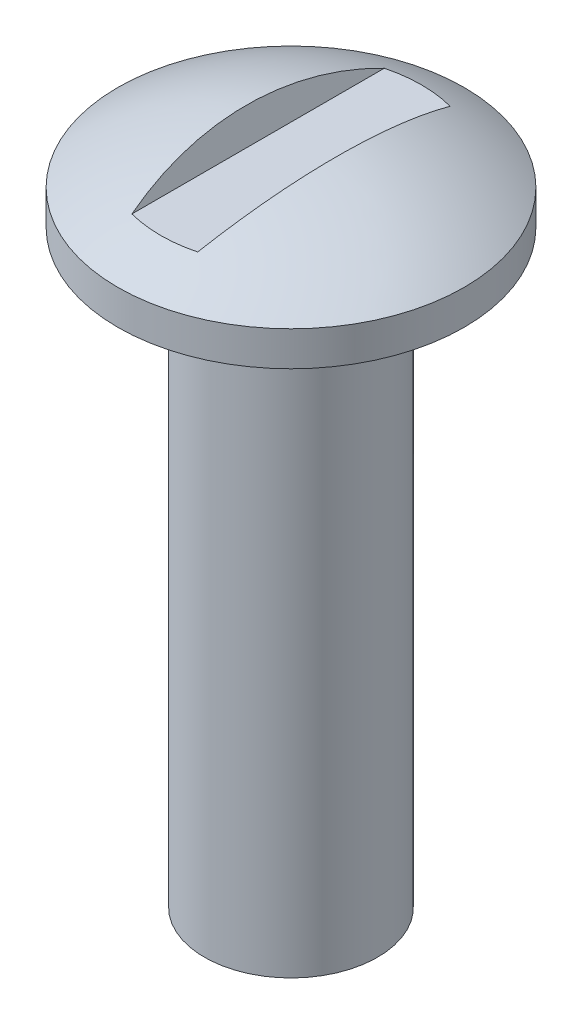
from build123d import *

# Parameters (mm, degrees)
DOME1_FACE_RADIUS       = 12.7
DOME1_HEIGHT            = 3.81
CUT_EXTRUDE1_DEPTH      = 53.685870022
CUT_EXTRUDE1_DEPTH_BACK = 53.685870022


with BuildPart() as part:
    # Sketch1 → Revolve2 (revolve)
    with BuildSketch(Plane.XY, mode=Mode.PRIVATE) as revolve2_sk:
        Polygon((0, 0), (0, 45.72), (-12.7, 45.72), (-12.7, 43.18), (-6.35, 43.18), (-6.35, 0), (-0.453180755, 0), align=None)
    revolve(revolve2_sk.sketch.rotate(Axis((0, 0, 0), (0, 1, 0)), 270), axis=Axis((0, 0, 0), (0, 1, 0)))

    # Dome1: a dome of height H over a round flat face of radius A is a cap of a sphere of radius (A * A + H * H) / (2 * H)
    dome1_r = (DOME1_FACE_RADIUS * DOME1_FACE_RADIUS + DOME1_HEIGHT * DOME1_HEIGHT) / (2 * DOME1_HEIGHT)
    dome1_base = Plane((0, 45.72, 0), z_dir=(0, 1, 0))
    with Locations(dome1_base.offset(DOME1_HEIGHT - dome1_r)):
        dome1_ball = Sphere(dome1_r, mode=Mode.PRIVATE)
    add(split(dome1_ball, bisect_by=dome1_base, keep=Keep.TOP, mode=Mode.PRIVATE))

    # Sketch2 → Cut-Extrude1 (cut, two sides: drawn at the far end of the back side and taken through both)
    with BuildSketch(Plane.XY.offset(-CUT_EXTRUDE1_DEPTH_BACK)):
        Polygon((7.09988746, 57.306992364), (-7.09988746, 57.306992364), (-2.413050327, 47.453982482), (2.413050327, 47.453982482), align=None)
    extrude(amount=CUT_EXTRUDE1_DEPTH + CUT_EXTRUDE1_DEPTH_BACK, mode=Mode.SUBTRACT)


solid = part.part
